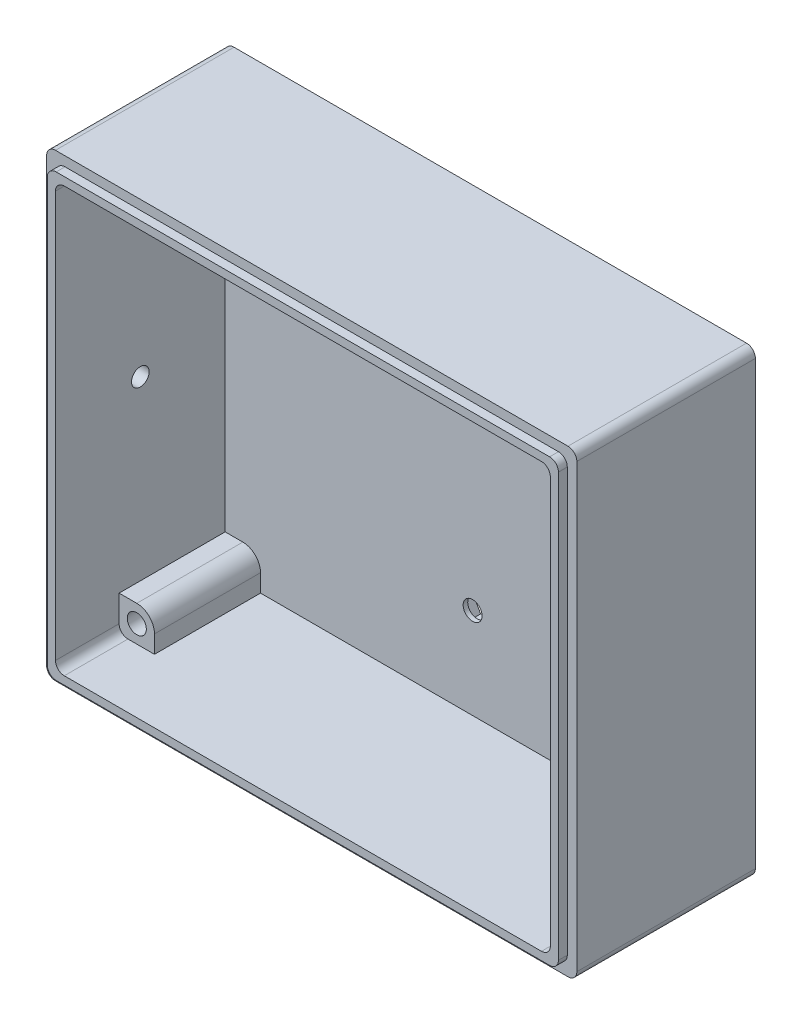
from build123d import *

# Parameters (mm, degrees)
SKETCH1_W                                    = 95.25
SKETCH1_H                                    = 82.55
BOSS_EXTRUDE1_DEPTH                          = 3.175
SKETCH2_W                                    = 95.25
SKETCH2_H                                    = 82.55
SKETCH2_W_2                                  = 88.9
SKETCH2_H_2                                  = 76.2
BOSS_EXTRUDE2_DEPTH                          = 28.9
SKETCH3_W                                    = 91.821
SKETCH3_H                                    = 79.121
SKETCH3_W_2                                  = 88.9
SKETCH3_H_2                                  = 76.2
BOSS_EXTRUDE3_DEPTH                          = 1.5875
FILLET1_R                                    = 1.5875
SKETCH4_R                                    = 1.7018
CUT_EXTRUDE1_DEPTH                           = 72.448793945
CUT_EXTRUDE2_DEPTH                           = 2.35
BOSS_EXTRUDE4_START                          = 19.05
SKETCH7_R                                    = 3.175
SKETCH7_R_2                                  = 1.7145
BOSS_EXTRUDE4_DEPTH                          = 19.05
SKETCH8_R                                    = 1.7145
CUT_EXTRUDE3_DEPTH                           = 67.826019446
MIRROR1_START                                = 19.05
MIRROR1_AT_THE_SECOND_PLANE_COPY_1_SKETC_R   = 3.175
MIRROR1_AT_THE_SECOND_PLANE_COPY_1_SKETC_R_2 = 1.7145
MIRROR1_AT_THE_SECOND_PLANE_COPY_1_DEPTH     = 19.05
MIRROR1_AT_THE_SECOND_PLANE_COPY_2_SKETC_R   = 1.7145
MIRROR1_AT_THE_SECOND_PLANE_COPY_2_DEPTH     = 67.826019446
CUT_EXTRUDE4_DEPTH                           = 2.4
MIRROR2_AT_THE_SECOND_PLANE_COPY_1_DEPTH     = 2.4
CUT_EXTRUDE5_DEPTH                           = 107.370085815


with BuildPart() as part:
    # Sketch1 → Boss-Extrude1 (new body)
    with BuildSketch(Plane.XY):
        Rectangle(SKETCH1_W, SKETCH1_H)
    extrude(amount=BOSS_EXTRUDE1_DEPTH)

    # Sketch2 → Boss-Extrude2 (add)
    with BuildSketch(Plane.XY.offset(3.175)):
        Rectangle(SKETCH2_W, SKETCH2_H)
        Rectangle(SKETCH2_W_2, SKETCH2_H_2, mode=Mode.SUBTRACT)
    extrude(amount=BOSS_EXTRUDE2_DEPTH)

    # Sketch3 → Boss-Extrude3 (add)
    with BuildSketch(Plane.XY.offset(32.075)):
        Rectangle(SKETCH3_W, SKETCH3_H)
        Rectangle(SKETCH3_W_2, SKETCH3_H_2, mode=Mode.SUBTRACT)
    extrude(amount=BOSS_EXTRUDE3_DEPTH)

    # Fillet1
    fillet1_edges = [part.edges().sort_by_distance(p)[0] for p in [
        (44.45, 38.1, 18.41875),
        (-44.45, 38.1, 18.41875),
        (-44.45, -38.1, 18.41875),
        (44.45, -38.1, 18.41875),
        (45.9105, -39.5605, 32.86875),
        (45.9105, 39.5605, 32.86875),
        (-45.9105, 39.5605, 32.86875),
        (-45.9105, -39.5605, 32.86875),
        (47.625, -41.275, 16.0375),
        (-47.625, -41.275, 16.0375),
        (-47.625, 41.275, 16.0375),
        (47.625, 41.275, 16.0375),
    ]]
    fillet(fillet1_edges, radius=FILLET1_R)

    # Sketch4 → Cut-Extrude1 (cut, through all)
    with BuildSketch(Plane(origin=(0, 0, 0), x_dir=(-1, 0, 0), z_dir=(0, 0, -1))):
        with Locations((0, 21.749999934)):
            Circle(SKETCH4_R)
        with Locations((0, -21.749999934)):
            Circle(SKETCH4_R)
    extrude(amount=-CUT_EXTRUDE1_DEPTH, mode=Mode.SUBTRACT)

    # Sketch5 → Cut-Extrude2 (cut)
    with BuildSketch(Plane(origin=(0, 0, 0), x_dir=(-1, 0, 0), z_dir=(0, 0, -1))):
        Polygon((3.446203757, 21.749999934), (1.723101878, 24.734499934), (-1.723101878, 24.734499934), (-3.446203757, 21.749999934), (-1.723101878, 18.765499934), (1.723101878, 18.765499934), align=None)
        Polygon((1.723101878, -18.765499934), (3.446203757, -21.749999934), (1.723101878, -24.734499934), (-1.723101878, -24.734499934), (-3.446203757, -21.749999934), (-1.723101878, -18.765499934), align=None)
    extrude(amount=-CUT_EXTRUDE2_DEPTH, mode=Mode.SUBTRACT)

    # Sketch7 → Boss-Extrude4 (add)
    # profile 1 of 4: a face of its own
    with BuildSketch(Plane.XY.offset(3.175).offset(BOSS_EXTRUDE4_START)):
        with BuildLine():
            ThreePointArc((-44.45, 34.925), (-43.520064053, 37.170064008), (-41.275000064, 38.1))
            Line((-41.275000064, 38.1), (-42.8625, 38.1))
            ThreePointArc((-42.8625, 38.1), (-43.985032015, 37.635032015), (-44.45, 36.5125))
            Line((-44.45, 36.5125), (-44.45, 34.925))
        make_face()
    # profile 2 of 4: a face of its own
    with BuildSketch(Plane.XY.offset(3.175).offset(BOSS_EXTRUDE4_START)):
        with BuildLine():
            Line((-44.45, 34.925), (-44.45, 31.75))
            Line((-44.45, 31.75), (-41.275, 31.75))
            ThreePointArc((-41.275, 31.75), (-43.52006403, 32.67993597), (-44.45, 34.925))
        make_face()
    # profile 3 of 4: a face of its own
    with BuildSketch(Plane.XY.offset(3.175).offset(BOSS_EXTRUDE4_START)):
        with BuildLine():
            Line((-38.1, 34.925), (-38.1, 38.1))
            Line((-38.1, 38.1), (-41.275000064, 38.1))
            ThreePointArc((-41.275000064, 38.1), (-39.029935992, 37.170064053), (-38.1, 34.925))
        make_face()
    # profile 4 of 4: a face of its own
    with BuildSketch(Plane.XY.offset(3.175).offset(BOSS_EXTRUDE4_START)):
        with Locations((-41.275, 34.925)):
            Circle(SKETCH7_R)
        with Locations(Location((-41.275, 34.925, 0), (0, 0, 180))):
            Circle(SKETCH7_R_2, mode=Mode.SUBTRACT)
    boss_extrude4 = extrude(amount=-BOSS_EXTRUDE4_DEPTH)

    # Sketch8 → Cut-Extrude3 (cut, through all)
    with BuildSketch(Plane.XY.offset(22.225)):
        with Locations(Location((-41.275, 34.925, 0), (0, 0, 180))):
            Circle(SKETCH8_R)
    cut_extrude3 = extrude(amount=-CUT_EXTRUDE3_DEPTH, mode=Mode.SUBTRACT)

    # Mirror1: Boss-Extrude4, Cut-Extrude3 across plane
    add(boss_extrude4.mirror(Plane(origin=(0, 0, 0), x_dir=(0, 0, 1), z_dir=(1, 0, 0))))
    add(cut_extrude3.mirror(Plane(origin=(0, 0, 0), x_dir=(0, 0, 1), z_dir=(1, 0, 0))), mode=Mode.SUBTRACT)

    # Mirror1 at the second plane: Boss-Extrude4, Cut-Extrude3 across plane
    add(boss_extrude4.mirror(Plane.ZX))
    add(cut_extrude3.mirror(Plane.ZX), mode=Mode.SUBTRACT)

    # Mirror1 at the second plane copy 1 sketc → Mirror1 at the second plane copy 1 (add)
    # profile 1 of 4: a face of its own
    with BuildSketch(Plane(origin=(0, 0, 3.175), x_dir=(-1, 0, 0), z_dir=(0, 0, 1)).offset(MIRROR1_START)):
        with BuildLine():
            ThreePointArc((-44.45, 34.925), (-43.520064053, 37.170064008), (-41.275000064, 38.1))
            Line((-41.275000064, 38.1), (-42.8625, 38.1))
            ThreePointArc((-42.8625, 38.1), (-43.985032015, 37.635032015), (-44.45, 36.5125))
            Line((-44.45, 36.5125), (-44.45, 34.925))
        make_face()
    # profile 2 of 4: a face of its own
    with BuildSketch(Plane(origin=(0, 0, 3.175), x_dir=(-1, 0, 0), z_dir=(0, 0, 1)).offset(MIRROR1_START)):
        with BuildLine():
            Line((-44.45, 34.925), (-44.45, 31.75))
            Line((-44.45, 31.75), (-41.275, 31.75))
            ThreePointArc((-41.275, 31.75), (-43.52006403, 32.67993597), (-44.45, 34.925))
        make_face()
    # profile 3 of 4: a face of its own
    with BuildSketch(Plane(origin=(0, 0, 3.175), x_dir=(-1, 0, 0), z_dir=(0, 0, 1)).offset(MIRROR1_START)):
        with BuildLine():
            Line((-38.1, 34.925), (-38.1, 38.1))
            Line((-38.1, 38.1), (-41.275000064, 38.1))
            ThreePointArc((-41.275000064, 38.1), (-39.029935992, 37.170064053), (-38.1, 34.925))
        make_face()
    # profile 4 of 4: a face of its own
    with BuildSketch(Plane(origin=(0, 0, 3.175), x_dir=(-1, 0, 0), z_dir=(0, 0, 1)).offset(MIRROR1_START)):
        with Locations((-41.275, 34.925)):
            Circle(MIRROR1_AT_THE_SECOND_PLANE_COPY_1_SKETC_R)
        with Locations(Location((-41.275, 34.925, 0), (0, 0, 180))):
            Circle(MIRROR1_AT_THE_SECOND_PLANE_COPY_1_SKETC_R_2, mode=Mode.SUBTRACT)
    extrude(amount=-MIRROR1_AT_THE_SECOND_PLANE_COPY_1_DEPTH)

    # Mirror1 at the second plane copy 2 sketc → Mirror1 at the second plane copy 2 (cut, through all)
    with BuildSketch(Plane(origin=(0, 0, 22.225), x_dir=(-1, 0, 0), z_dir=(0, 0, 1))):
        with Locations(Location((-41.275, 34.925, 0), (0, 0, 180))):
            Circle(MIRROR1_AT_THE_SECOND_PLANE_COPY_2_SKETC_R)
    extrude(amount=-MIRROR1_AT_THE_SECOND_PLANE_COPY_2_DEPTH, mode=Mode.SUBTRACT)

    # Sketch9 → Cut-Extrude4 (cut)
    with BuildSketch(Plane(origin=(0, 0, 0), x_dir=(-1, 0, 0), z_dir=(0, 0, -1))):
        Polygon((-37.828218894, 34.925), (-39.551609447, 37.909999999), (-42.998390553, 37.909999999), (-44.721781106, 34.925), (-42.998390553, 31.940000001), (-39.551609447, 31.940000001), align=None)
    cut_extrude4 = extrude(amount=-CUT_EXTRUDE4_DEPTH, mode=Mode.SUBTRACT)

    # Mirror2: Cut-Extrude4 across plane
    add(cut_extrude4.mirror(Plane(origin=(0, 0, 0), x_dir=(0, 0, 1), z_dir=(1, 0, 0))), mode=Mode.SUBTRACT)

    # Mirror2 at the second plane: Cut-Extrude4 across plane
    add(cut_extrude4.mirror(Plane.ZX), mode=Mode.SUBTRACT)

    # Mirror2 at the second plane copy 1 sketc → Mirror2 at the second plane copy 1 (cut)
    with BuildSketch(Plane(origin=(0, 0, 0), x_dir=(1, 0, 0), z_dir=(0, 0, -1))):
        Polygon((-37.828218894, 34.925), (-39.551609447, 37.909999999), (-42.998390553, 37.909999999), (-44.721781106, 34.925), (-42.998390553, 31.940000001), (-39.551609447, 31.940000001), align=None)
    extrude(amount=-MIRROR2_AT_THE_SECOND_PLANE_COPY_1_DEPTH, mode=Mode.SUBTRACT)

    # Sketch10 → Cut-Extrude5 (cut, through all)
    with BuildSketch(Plane(origin=(-44.45, 0, 0), x_dir=(0, 0, -1), z_dir=(1, 0, 0))):
        with BuildLine():
            ThreePointArc((-20.00625, 0), (-18.41875, -1.5875), (-16.83125, 0))
            Line((-16.83125, 0), (-20.00625, 0))
        make_face()
        with BuildLine():
            Line((-20.00625, 0), (-16.83125, 0))
            ThreePointArc((-16.83125, 0), (-18.41875, 1.5875), (-20.00625, 0))
        make_face()
    extrude(amount=-CUT_EXTRUDE5_DEPTH, mode=Mode.SUBTRACT)


solid = part.part
